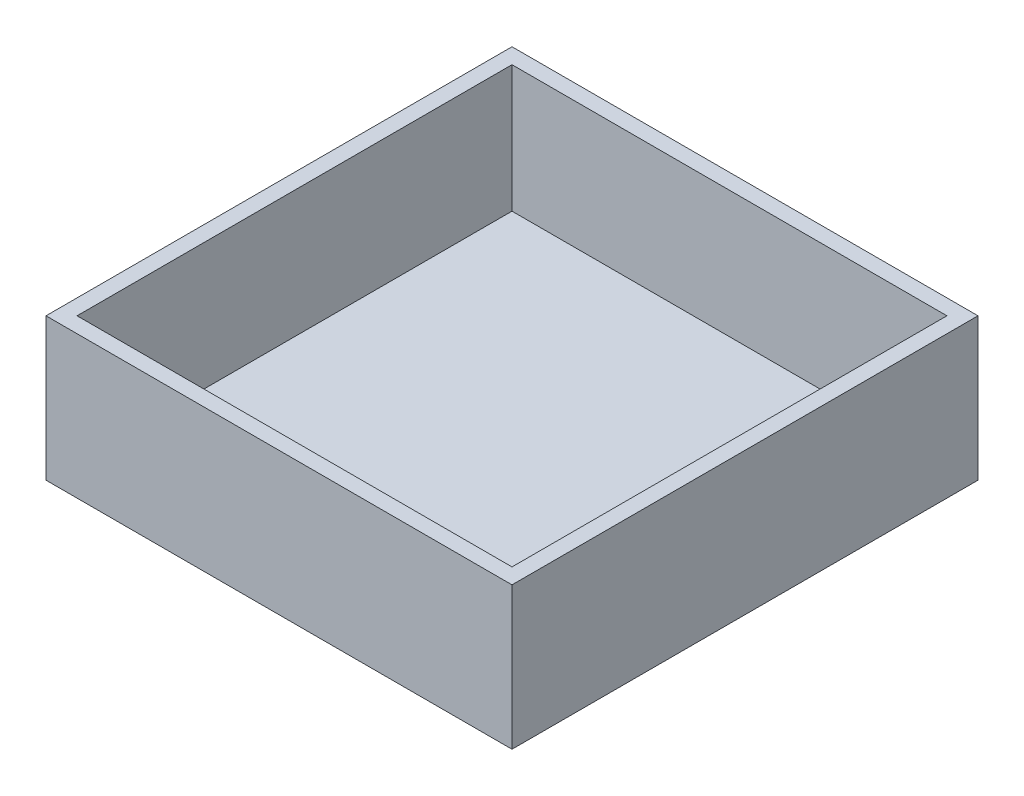
from build123d import *

# Parameters (mm, degrees)
SKETCH1_W           = 90
SKETCH1_H           = 90
BOSS_EXTRUDE1_DEPTH = 27.5
SKETCH2_W           = 84
SKETCH2_H           = 84
CUT_EXTRUDE1_DEPTH  = 24.5


with BuildPart() as part:
    # Sketch1 → Boss-Extrude1 (new body)
    with BuildSketch(Plane(origin=(0, 0, 0), x_dir=(1, 0, 0), z_dir=(0, 1, 0))):
        Rectangle(SKETCH1_W, SKETCH1_H)
    extrude(amount=BOSS_EXTRUDE1_DEPTH)

    # Sketch2 → Cut-Extrude1 (cut)
    with BuildSketch(Plane(origin=(0, 27.5, 0), x_dir=(1, 0, 0), z_dir=(0, 1, 0))):
        Rectangle(SKETCH2_W, SKETCH2_H)
    extrude(amount=-CUT_EXTRUDE1_DEPTH, mode=Mode.SUBTRACT)


solid = part.part
